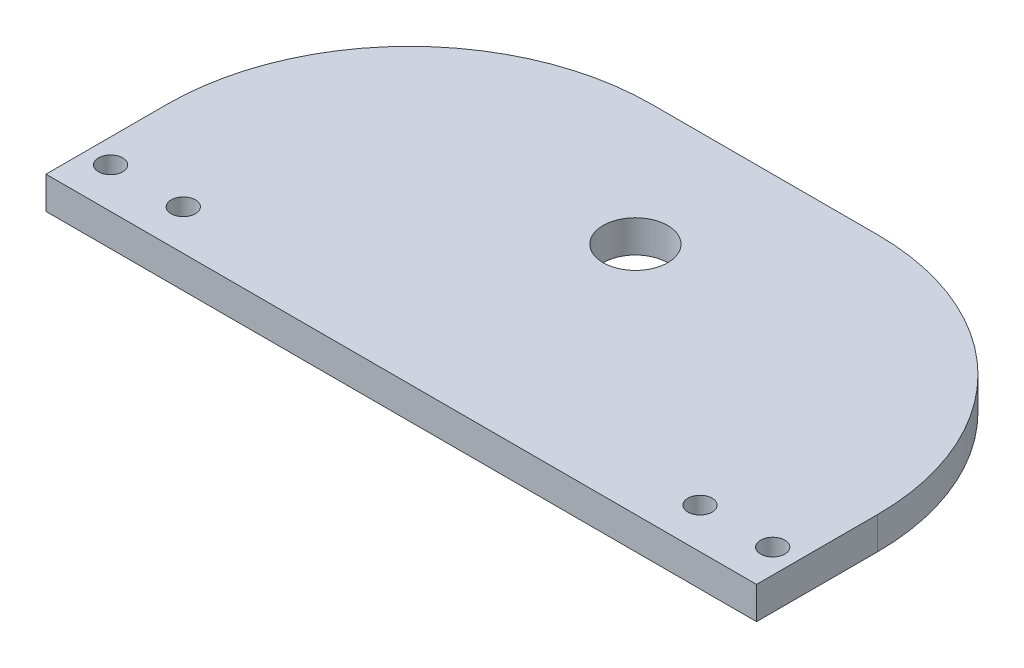
from build123d import *

# Parameters (mm, degrees)
SKETCH_1_W          = 88
SKETCH_1_H          = 45
EXTRUDE_1_DEPTH     = 4
SKETCH_2_R          = 4
CUT_EXTRUDE_1_DEPTH = 4
SKETCH_3_R          = 1.5
CUT_EXTRUDE_2_DEPTH = 50.580742229
FILLET_1_R          = 30


with BuildPart() as part:
    # 草图1 → 凸台-拉伸1 (new body)
    with BuildSketch(Plane(origin=(0, 0, 0), x_dir=(1, 0, 0), z_dir=(0, 1, 0))):
        Rectangle(SKETCH_1_W, SKETCH_1_H)
    extrude(amount=EXTRUDE_1_DEPTH)

    # 草图2 → 切除-拉伸1 (cut)
    with BuildSketch(Plane(origin=(0, 4, 0), x_dir=(1, 0, 0), z_dir=(0, 1, 0))):
        with Locations(Location((0, 6.5, 0), (0, 0, 270))):
            Circle(SKETCH_2_R)
    extrude(amount=-CUT_EXTRUDE_1_DEPTH, mode=Mode.SUBTRACT)

    # 草图3 → 切除-拉伸2 (cut, through all)
    with BuildSketch(Plane(origin=(0, 4, 0), x_dir=(1, 0, 0), z_dir=(0, 1, 0))):
        with Locations(Location((-41, -17.5, 0), (0, 0, 270))):
            Circle(SKETCH_3_R)
        with Locations(Location((-32, -17.5, 0), (0, 0, 90))):
            Circle(SKETCH_3_R)
        with Locations(Location((32, -17.5, 0), (0, 0, 270))):
            Circle(SKETCH_3_R)
        with Locations(Location((41, -17.5, 0), (0, 0, 90))):
            Circle(SKETCH_3_R)
    extrude(amount=-CUT_EXTRUDE_2_DEPTH, mode=Mode.SUBTRACT)

    # 圆角1
    fillet_1_edges = [part.edges().sort_by_distance(p)[0] for p in [
        (-44, 2, -22.5),
        (44, 2, -22.5),
    ]]
    fillet(fillet_1_edges, radius=FILLET_1_R)


solid = part.part
